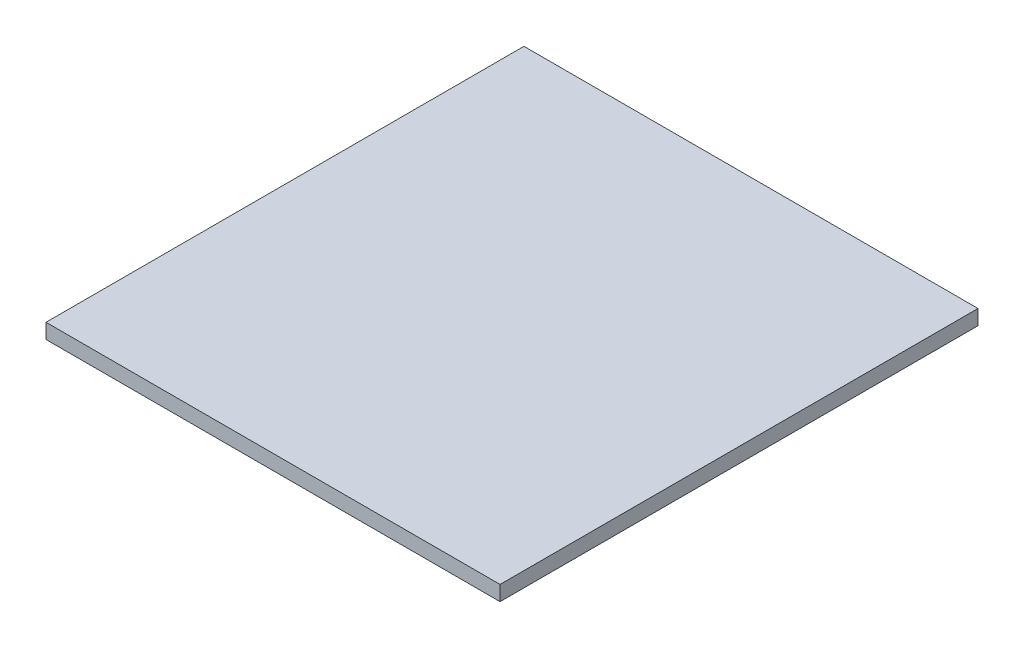
from build123d import *

# Parameters (mm, degrees)
SKETCH1_W           = 96.52
SKETCH1_H           = 101.6
BOSS_EXTRUDE1_DEPTH = 3.175


with BuildPart() as part:
    # Sketch1 → Boss-Extrude1 (new body)
    with BuildSketch(Plane(origin=(0, 0, 0), x_dir=(1, 0, 0), z_dir=(0, 1, 0))):
        with Locations((48.26, 50.8)):
            Rectangle(SKETCH1_W, SKETCH1_H)
    extrude(amount=BOSS_EXTRUDE1_DEPTH)


solid = part.part
